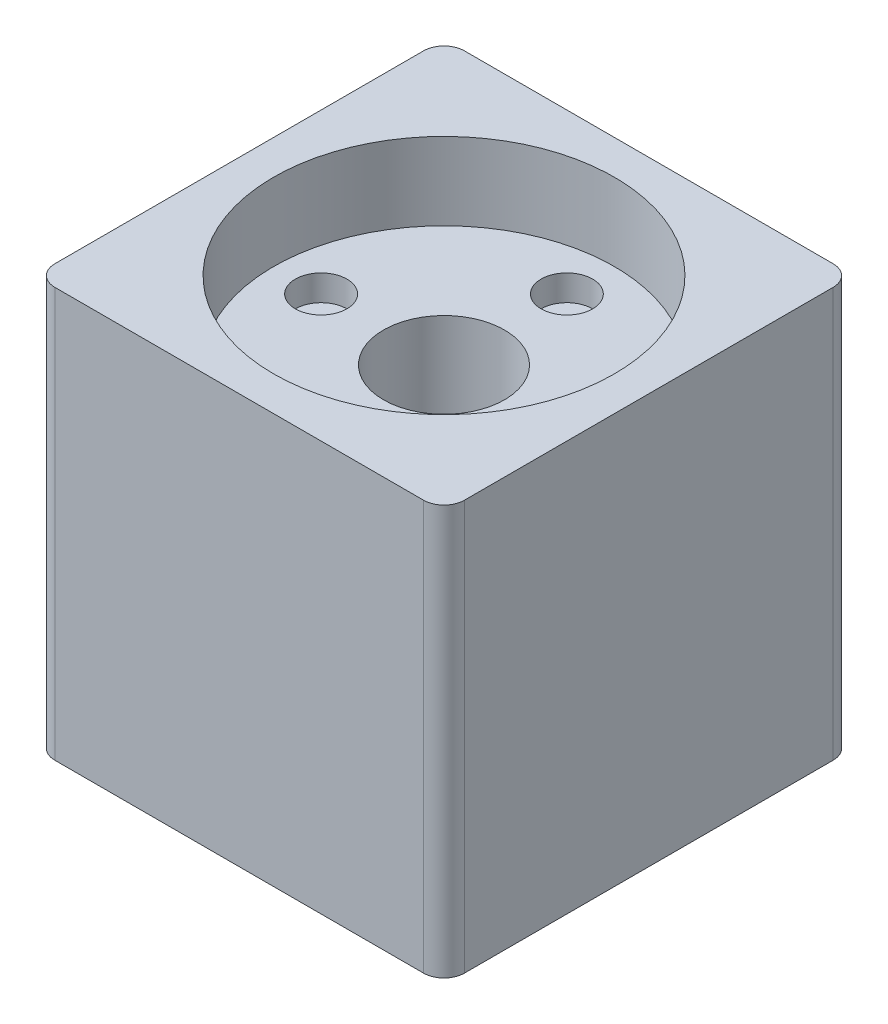
from build123d import *

# Parameters (mm, degrees)
SKETCH1_W           = 15.875
SKETCH1_H           = 15.875
SKETCH1_R           = 2.34506403
BOSS_EXTRUDE1_DEPTH = 7.9375
SKETCH2_R           = 6.604
CUT_EXTRUDE1_DEPTH  = 3
SKETCH3_R           = 1
CUT_EXTRUDE2_DEPTH  = 1
FILLET1_R           = 0.79375
CIRPATTERN1_COUNT   = 4


with BuildPart() as part:
    # Sketch1 → Boss-Extrude1 (new, symmetric)
    with BuildSketch(Plane(origin=(0, 0, 0), x_dir=(1, 0, 0), z_dir=(0, 1, 0))):
        Rectangle(SKETCH1_W, SKETCH1_H)
        Circle(SKETCH1_R, mode=Mode.SUBTRACT)
    extrude(amount=BOSS_EXTRUDE1_DEPTH, both=True)

    # Sketch2 → Cut-Extrude1 (cut)
    with BuildSketch(Plane(origin=(0, 7.9375, 0), x_dir=(1, 0, 0), z_dir=(0, 1, 0))):
        Circle(SKETCH2_R)
    extrude(amount=-CUT_EXTRUDE1_DEPTH, mode=Mode.SUBTRACT)

    # Sketch3 → Cut-Extrude2 (cut)
    with BuildSketch(Plane(origin=(0, 4.9375, 0), x_dir=(1, 0, 0), z_dir=(0, 1, 0))):
        with Locations((-4.7625, 0)):
            Circle(SKETCH3_R)
    cut_extrude2 = extrude(amount=-CUT_EXTRUDE2_DEPTH, mode=Mode.SUBTRACT)

    # Fillet1
    fillet1_edges = [part.edges().sort_by_distance(p)[0] for p in [
        (7.9375, 0, 7.9375),
        (7.9375, 0, -7.9375),
        (-7.9375, 0, 7.9375),
        (-7.9375, 0, -7.9375),
    ]]
    fillet(fillet1_edges, radius=FILLET1_R)

    # CirPattern1: Cut-Extrude2 ×4 about axis
    cirpattern1_axis = Axis((0, -8.73125, 0), (0, 1, 0))
    for i in range(1, CIRPATTERN1_COUNT):
        add(cut_extrude2.rotate(cirpattern1_axis, i * 360 / CIRPATTERN1_COUNT), mode=Mode.SUBTRACT)


solid = part.part
